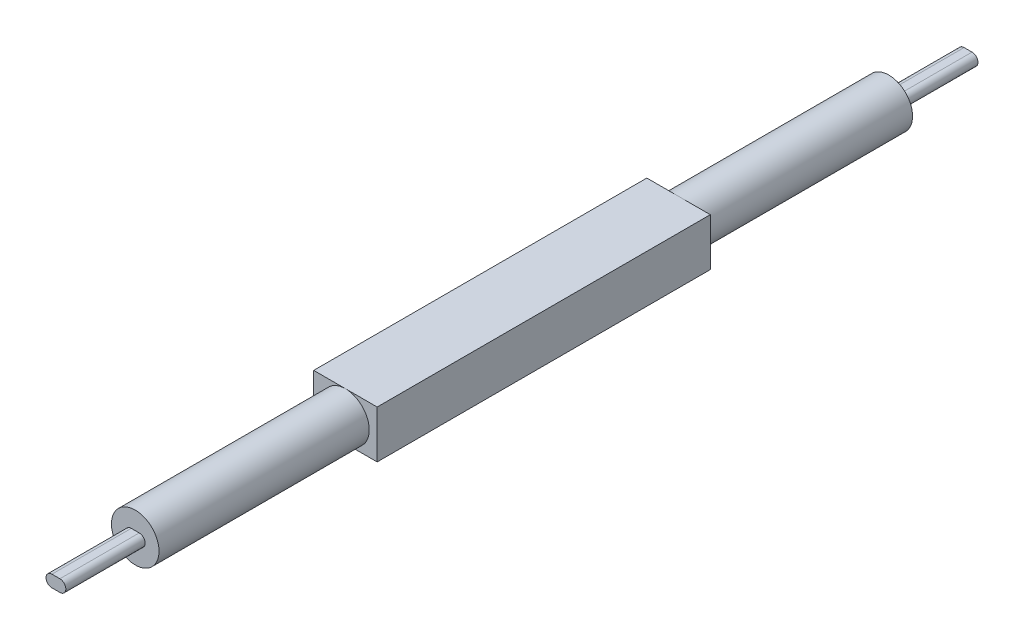
from build123d import *

# Parameters (mm, degrees)
ESQUISSE1_R             = 6
BOSS_EXTRU_1_DEPTH      = 190
BOSS_EXTRU_2_DEPTH      = 20
BOSS_EXTRU_3_START      = 20
BOSS_EXTRU_3_DEPTH      = 20
BOSS_EXTRU_5_DEPTH      = 8
BOSS_EXTRU_5_DEPTH_BACK = 8
ESQUISSE5_W             = 84
ESQUISSE5_H             = 12


with BuildPart() as part:
    # Esquisse1 → Boss.-Extru.1 (new body)
    with BuildSketch(Plane.XY):
        Circle(ESQUISSE1_R)
    extrude(amount=BOSS_EXTRU_1_DEPTH)

    # Esquisse2 → Boss.-Extru.2 (add)
    with BuildSketch(Plane.XY.offset(190)):
        with BuildLine():
            Line((-1, 1.5), (1, 1.5))
            ThreePointArc((1, 1.5), (2.5, 0), (1, -1.5))
            Line((1, -1.5), (-1, -1.5))
            ThreePointArc((-1, -1.5), (-2.5, 0), (-1, 1.5))
        make_face()
    extrude(amount=BOSS_EXTRU_2_DEPTH)

    # Esquisse3 → Boss.-Extru.3 (add)
    with BuildSketch(Plane(origin=(0, 0, 0), x_dir=(-1, 0, 0), z_dir=(0, 0, -1)).offset(BOSS_EXTRU_3_START)):
        with BuildLine():
            Line((-1, 1.5), (1, 1.5))
            ThreePointArc((1, 1.5), (2.5, 0), (1, -1.5))
            Line((1, -1.5), (-1, -1.5))
            ThreePointArc((-1, -1.5), (-2.5, 0), (-1, 1.5))
        make_face()
    extrude(amount=-BOSS_EXTRU_3_DEPTH)

    # Esquisse5 → Boss.-Extru.5 (add, two sides: drawn at the far end of the back side and taken through both)
    with BuildSketch(Plane(origin=(0, 0, 0), x_dir=(0, 0, -1), z_dir=(-1, 0, 0)).offset(-BOSS_EXTRU_5_DEPTH_BACK)):
        with Locations((-95, 0)):
            Rectangle(ESQUISSE5_W, ESQUISSE5_H)
    extrude(amount=BOSS_EXTRU_5_DEPTH + BOSS_EXTRU_5_DEPTH_BACK)


solid = part.part
